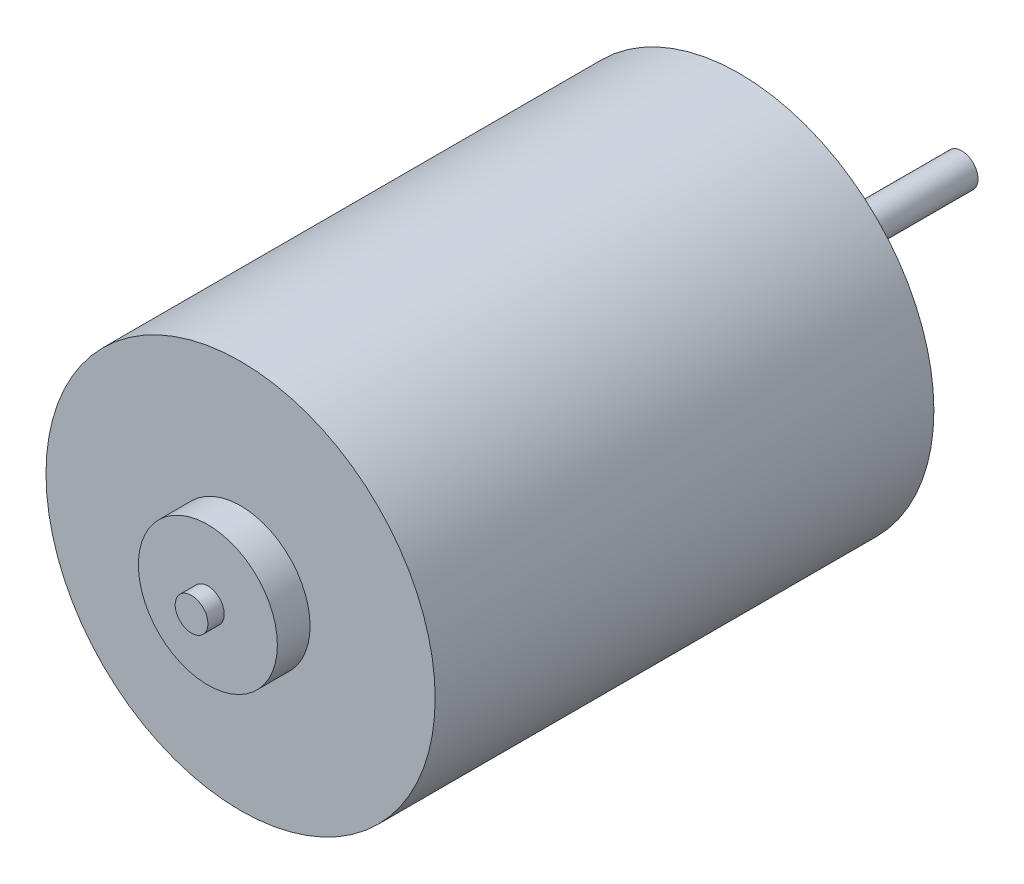
from build123d import *

# Parameters (mm, degrees)
SKETCH2_R           = 11.9
BOSS_EXTRUDE1_DEPTH = 30.5
SKETCH3_R           = 4.25
BOSS_EXTRUDE2_DEPTH = 2
SKETCH4_R           = 3.15
BOSS_EXTRUDE3_DEPTH = 1.6
SKETCH5_R           = 1
BOSS_EXTRUDE4_DEPTH = 12
BOSS_EXTRUDE5_START = 1
SKETCH6_R           = 1
BOSS_EXTRUDE5_DEPTH = 1


with BuildPart() as part:
    # Sketch2 → Boss-Extrude1 (new body)
    with BuildSketch(Plane.XY):
        with Locations(Location((0, 0, 0), (0, 0, 180))):
            Circle(SKETCH2_R)
    extrude(amount=BOSS_EXTRUDE1_DEPTH)

    # Sketch3 → Boss-Extrude2 (add)
    with BuildSketch(Plane.XY.offset(30.5)):
        Circle(SKETCH3_R)
    extrude(amount=BOSS_EXTRUDE2_DEPTH)

    # Sketch4 → Boss-Extrude3 (add)
    with BuildSketch(Plane(origin=(0, 0, 0), x_dir=(-1, 0, 0), z_dir=(0, 0, -1))):
        Circle(SKETCH4_R)
    extrude(amount=BOSS_EXTRUDE3_DEPTH)

    # Sketch5 → Boss-Extrude4 (add)
    with BuildSketch(Plane(origin=(0, 0, -1.6), x_dir=(-1, 0, 0), z_dir=(0, 0, -1))):
        Circle(SKETCH5_R)
    extrude(amount=BOSS_EXTRUDE4_DEPTH)

    # Sketch6 → Boss-Extrude5 (add)
    with BuildSketch(Plane.XY.offset(32.5).offset(BOSS_EXTRUDE5_START)):
        with Locations(Location((0, 0, 0), (0, 0, 180))):
            Circle(SKETCH6_R)
    extrude(amount=-BOSS_EXTRUDE5_DEPTH)


solid = part.part
